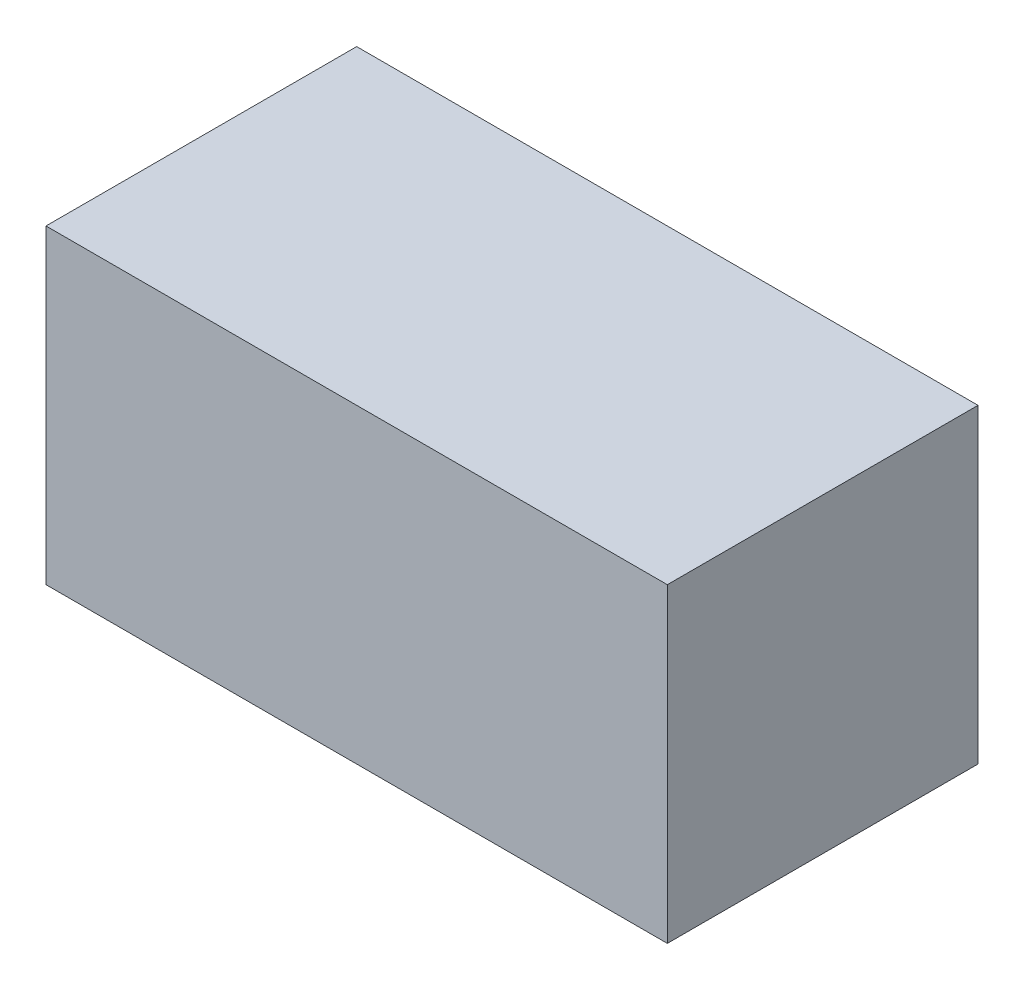
from build123d import *

# Parameters (mm, degrees)
SKETCH1_W           = 700
SKETCH1_H           = 350
BOSS_EXTRUDE1_DEPTH = 350


with BuildPart() as part:
    # Sketch1 → Boss-Extrude1 (new body)
    with BuildSketch(Plane.XY):
        with Locations((1950, -1625)):
            Rectangle(SKETCH1_W, SKETCH1_H)
    extrude(amount=BOSS_EXTRUDE1_DEPTH)


solid = part.part
